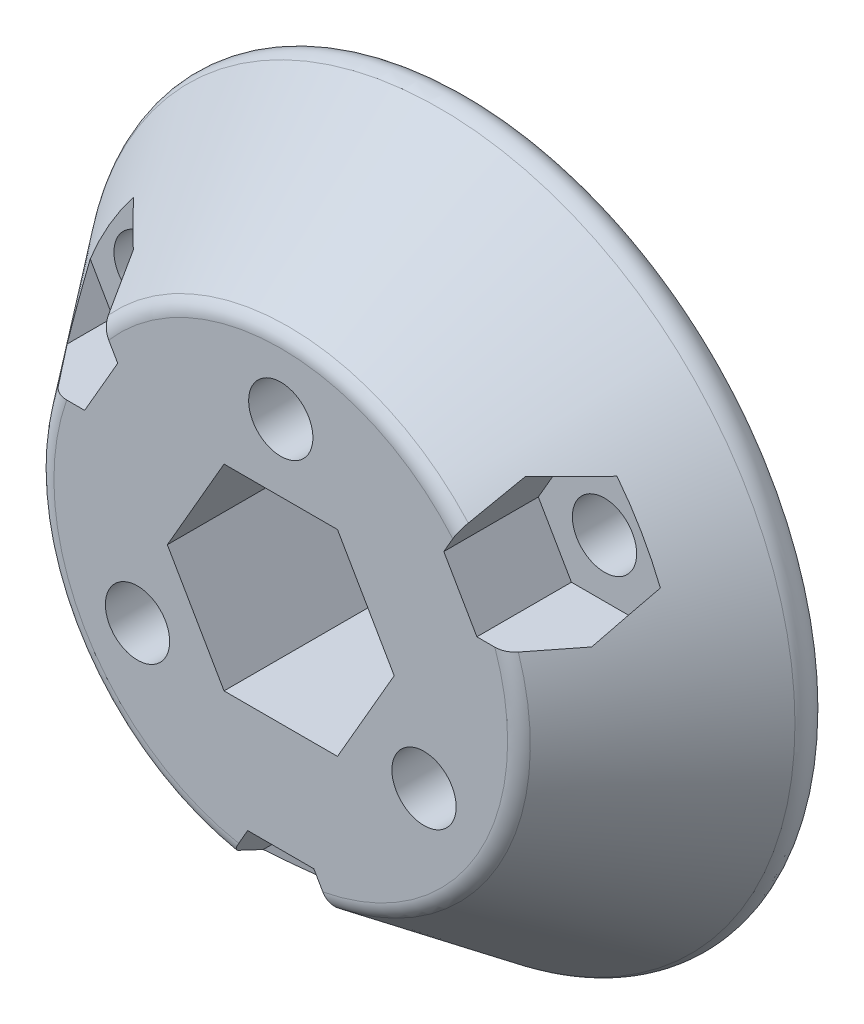
from build123d import *

# Parameters (mm, degrees)
SKETCH_1_R          = 20
SKETCH_2_R          = 12.5
FILLET_1_R          = 1
SKETCH_3_R          = 1.7
CUT_EXTRUDE_1_DEPTH = 29.670542506
CUT_EXTRUDE_2_DEPTH = 29.670542541
SKETCH_6_R          = 3
CUT_EXTRUDE_3_DEPTH = 5
CUT_EXTRUDE_4_DEPTH = 5


with BuildPart() as part:
    # 草图1 → 放样1 section 0
    with BuildSketch(Plane.XY):
        Circle(SKETCH_1_R)
    # 草图2 → 放样1 section 1
    with BuildSketch(Plane.XY.offset(10)):
        Circle(SKETCH_2_R)
    loft()

    # 圆角1
    fillet_1_edges = [part.edges().sort_by_distance(p)[0] for p in [
        (-12.5, 0, 10),
        (-20, 0, 0),
    ]]
    fillet(fillet_1_edges, radius=FILLET_1_R)

    # 草图3 → 切除-拉伸1 (cut, through all)
    with BuildSketch(Plane(origin=(0, 0, 0), x_dir=(-1, 0, 0), z_dir=(0, 0, -1))):
        with Locations((0, -14)):
            Circle(SKETCH_3_R)
        with Locations((-12.124355653, 7)):
            Circle(SKETCH_3_R)
        with Locations((12.124355653, 7)):
            Circle(SKETCH_3_R)
        with Locations((0, 8.75)):
            Circle(SKETCH_3_R)
        with Locations((7.577722283, -4.375)):
            Circle(SKETCH_3_R)
        with Locations((-7.577722283, -4.375)):
            Circle(SKETCH_3_R)
    extrude(amount=-CUT_EXTRUDE_1_DEPTH, mode=Mode.SUBTRACT)

    # 草图5 → 切除-拉伸2 (cut, through all)
    with BuildSketch(Plane(origin=(0, 0, 0), x_dir=(-1, 0, 0), z_dir=(0, 0, -1))):
        Polygon((-3, 5.196152423), (-6, 0), (-3, -5.196152423), (3, -5.196152423), (6, 0), (3, 5.196152423), align=None)
    extrude(amount=-CUT_EXTRUDE_2_DEPTH, mode=Mode.SUBTRACT)

    # 草图6 → 切除-拉伸3 (cut)
    with BuildSketch(Plane(origin=(0, 0, 0), x_dir=(-1, 0, 0), z_dir=(0, 0, -1))):
        with Locations((-7.577722283, -4.375)):
            Circle(SKETCH_6_R)
        with Locations((7.577722283, -4.375)):
            Circle(SKETCH_6_R)
        with Locations((0, 8.75)):
            Circle(SKETCH_6_R)
    extrude(amount=-CUT_EXTRUDE_3_DEPTH, mode=Mode.SUBTRACT)

    # 草图7 → 切除-拉伸4 (cut)
    with BuildSketch(Plane.XY.offset(10)):
        Polygon((-15.624355653, 7), (-13.874355653, 3.968911087), (-10.374355653, 3.968911087), (-8.624355653, 7), (-10.374355653, 10.031088913), (-13.874355653, 10.031088913), align=None)
        Polygon((13.874355653, 3.968911087), (15.624355653, 7), (13.874355653, 10.031088913), (10.374355653, 10.031088913), (8.624355653, 7), (10.374355653, 3.968911087), align=None)
        Polygon((-1.75, -10.968911087), (-3.5, -14), (-1.75, -17.031088913), (1.75, -17.031088913), (3.5, -14), (1.75, -10.968911087), align=None)
    extrude(amount=-CUT_EXTRUDE_4_DEPTH, mode=Mode.SUBTRACT)


solid = part.part
